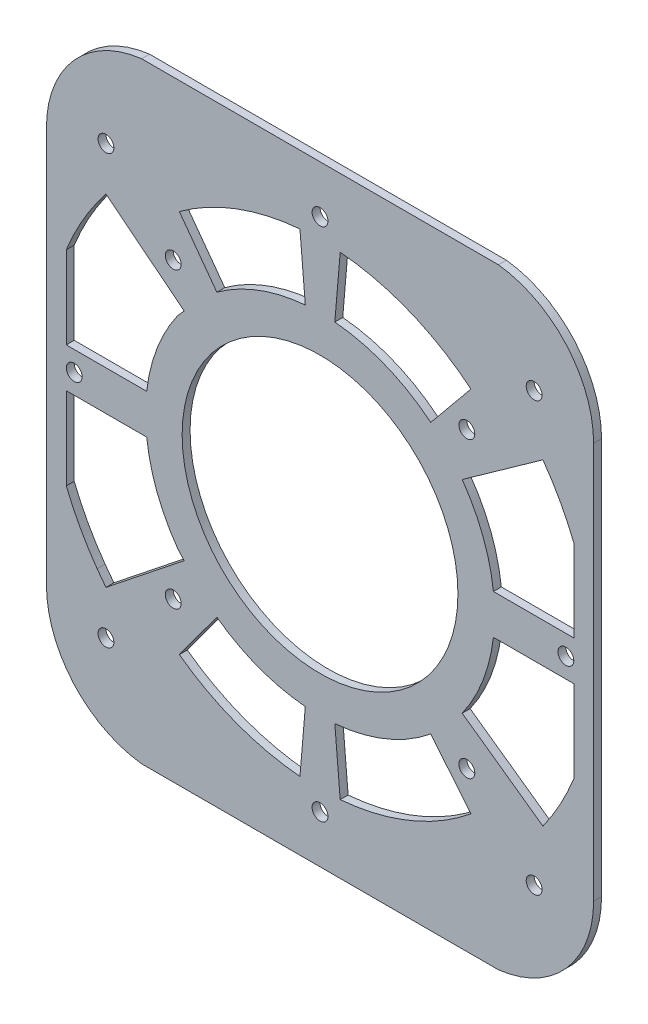
from build123d import *

# Parameters (mm, degrees)
SKETCH1_W           = 90
SKETCH1_H           = 100
SKETCH1_H_2         = 22
SKETCH1_W_2         = 24
BOSS_EXTRUDE1_DEPTH = 2
CUT_EXTRUDE1_DEPTH  = 10
CUT_EXTRUDE2_DEPTH  = 10
SKETCH4_R           = 30
CUT_EXTRUDE3_DEPTH  = 10
CUT_EXTRUDE4_DEPTH  = 10
CUT_EXTRUDE5_DEPTH  = 10
BOSS_EXTRUDE3_START = -2
SKETCH8_R           = 30
SKETCH8_R_2         = 28
BOSS_EXTRUDE3_DEPTH = 2
BOSS_EXTRUDE5_DEPTH = 2
BOSS_EXTRUDE6_DEPTH = 2
SKETCH11_R          = 34.778777804
CUT_EXTRUDE6_DEPTH  = 10
SKETCH12_R          = 2
CUT_EXTRUDE7_DEPTH  = 10


with BuildPart() as part:
    # Sketch1 → Boss-Extrude1 (new body)
    with BuildSketch(Plane.XY):
        Rectangle(SKETCH1_W, SKETCH1_H)
        with Locations((0, 61)):
            Rectangle(SKETCH1_W, SKETCH1_H_2)
        with Locations((57, 0)):
            Rectangle(SKETCH1_W_2, SKETCH1_H)
        with BuildLine():
            Line((45, 50), (69, 50))
            ThreePointArc((69, 50), (61.278820596, 65.667804287), (45, 72))
            Line((45, 72), (45, 50))
        make_face()
        with BuildLine():
            ThreePointArc((45, -72), (61.83891888, -66.278820596), (69, -50))
            Line((69, -50), (45, -50))
            Line((45, -50), (45, -72))
        make_face()
        with Locations((0, -61)):
            Rectangle(SKETCH1_W, SKETCH1_H_2)
        with BuildLine():
            Line((-45, -72), (-45, -50))
            Line((-45, -50), (-69, -50))
            ThreePointArc((-69, -50), (-61.278820596, -65.667804287), (-45, -72))
        make_face()
        with Locations((-57, 0)):
            Rectangle(SKETCH1_W_2, SKETCH1_H)
        with BuildLine():
            Line((-69, 50), (-45, 50))
            Line((-45, 50), (-45, 72))
            ThreePointArc((-45, 72), (-61.83891888, 66.278820596), (-69, 50))
        make_face()
    extrude(amount=BOSS_EXTRUDE1_DEPTH)

    # Sketch2 → Cut-Extrude1 (cut)
    with BuildSketch(Plane.XY.offset(2)):
        with BuildLine():
            Line((-60.760739313, 25.787593916), (-64, 15.649215929))
            Line((-64, 15.649215929), (-64, 5))
            Line((-64, 5), (-43.724760028, 5))
            ThreePointArc((-43.724760028, 5), (-41.091915324, 15.757827722), (-35.856683042, 25.517698186))
            Line((-35.856683042, 25.517698186), (-56.217391304, 40.007560722))
            ThreePointArc((-56.217391304, 40.007560722), (-60.52773874, 33.126920216), (-64, 25.787593916))
            Line((-64, 25.787593916), (-60.760739313, 25.787593916))
        make_face()
        with BuildLine():
            Line((-64, -5), (-64, -25.787593916))
            ThreePointArc((-64, -25.787593916), (-60.52773874, -33.126920216), (-56.217391304, -40.007560722))
            Line((-56.217391304, -40.007560722), (-35.856683042, -25.517698186))
            ThreePointArc((-35.856683042, -25.517698186), (-41.091915324, -15.757827722), (-43.724760028, -5))
            Line((-43.724760028, -5), (-64, -5))
        make_face()
        with BuildLine():
            Line((-35.483097289, 48.383362913), (-26.026680798, 35.488963441))
            ThreePointArc((-26.026680798, 35.488963441), (-15.448259809, 41.209293956), (-3.716315379, 43.852521472))
            Line((-3.716315379, 43.852521472), (-5.066584601, 59.785698294))
            ThreePointArc((-5.066584601, 59.785698294), (-21.061160661, 56.182092446), (-35.483097289, 48.383362913))
        make_face()
        with BuildLine():
            ThreePointArc((64, 25.787593916), (60.52773874, 33.126920216), (56.217391304, 40.007560722))
            Line((56.217391304, 40.007560722), (35.856683042, 25.517698186))
            ThreePointArc((35.856683042, 25.517698186), (41.091915324, 15.757827722), (43.724760028, 5))
            Line((43.724760028, 5), (64, 5))
            Line((64, 5), (64, 25.787593916))
        make_face()
        with BuildLine():
            Line((-26.026680798, -35.488963441), (-35.483097289, -48.383362913))
            ThreePointArc((-35.483097289, -48.383362913), (-21.061160661, -56.182092446), (-5.066584601, -59.785698294))
            Line((-5.066584601, -59.785698294), (-3.716315379, -43.852521472))
            ThreePointArc((-3.716315379, -43.852521472), (-15.448259809, -41.209293956), (-26.026680798, -35.488963441))
        make_face()
        with BuildLine():
            ThreePointArc((56.217391304, -40.007560722), (60.52773874, -33.126920216), (64, -25.787593916))
            Line((64, -25.787593916), (64, -5))
            Line((64, -5), (43.724760028, -5))
            ThreePointArc((43.724760028, -5), (41.091915324, -15.757827722), (35.856683042, -25.517698186))
            Line((35.856683042, -25.517698186), (56.217391304, -40.007560722))
        make_face()
        with BuildLine():
            Line((27.916279909, 34.022580083), (38.059254795, 46.384190458))
            ThreePointArc((38.059254795, 46.384190458), (22.588514074, 55.585600941), (5.084745763, 59.784156434))
            Line((5.084745763, 59.784156434), (3.729636503, 43.851390526))
            ThreePointArc((3.729636503, 43.851390526), (16.568566174, 40.771770312), (27.916279909, 34.022580083))
        make_face()
        with BuildLine():
            Line((3.729636503, -43.851390526), (5.084745763, -59.784156434))
            ThreePointArc((5.084745763, -59.784156434), (22.588514074, -55.585600941), (38.059254795, -46.384190458))
            Line((38.059254795, -46.384190458), (27.916279909, -34.022580083))
            ThreePointArc((27.916279909, -34.022580083), (16.568566174, -40.771770312), (3.729636503, -43.851390526))
        make_face()
    extrude(amount=-CUT_EXTRUDE1_DEPTH, mode=Mode.SUBTRACT)

    # Sketch3 → Cut-Extrude2 (cut)
    with BuildSketch(Plane.XY.offset(2)):
        Polygon((-64, 25.787593916), (-64, 15.649215929), (-60.760739313, 25.787593916), align=None)
    extrude(amount=-CUT_EXTRUDE2_DEPTH, mode=Mode.SUBTRACT)

    # Sketch4 → Cut-Extrude3 (cut)
    with BuildSketch(Plane(origin=(0, 0, 0), x_dir=(-1, 0, 0), z_dir=(0, 0, -1))):
        Circle(SKETCH4_R)
    extrude(amount=-CUT_EXTRUDE3_DEPTH, mode=Mode.SUBTRACT)

    # Sketch6 → Cut-Extrude4 (cut)
    with BuildSketch(Plane.XY.offset(2)):
        Polygon((-35.856683042, -25.517698186), (-56.217391304, -40.007560722), (-50.280397209, -40.007560722), (-34.257403731, -27.258240508), align=None)
        Polygon((-50.280397209, 40.007560722), (-56.217391304, 40.007560722), (-35.856683042, 25.517698186), (-34.257403731, 27.258240508), align=None)
        Polygon((-50.280397209, -40.007560722), (-56.217391304, -40.007560722), (-53.993303971, -42.96187992), align=None)
        Polygon((-53.993303971, 42.96187992), (-56.217391304, 40.007560722), (-50.280397209, 40.007560722), align=None)
    extrude(amount=-CUT_EXTRUDE4_DEPTH, mode=Mode.SUBTRACT)

    # Sketch7 → Cut-Extrude5 (cut)
    with BuildSketch(Plane.XY.offset(2)):
        Polygon((-32.560271117, 27.267561972), (-24.823321267, 33.603144582), (-18.487738656, 25.866194731), (-26.224688507, 19.530612121), align=None)
        Polygon((27.827762823, 32.155388995), (19.915267174, 26.040455421), (26.030200748, 18.127959772), (33.942696396, 24.242893346), align=None)
        Polygon((33.988304577, -25.549058378), (27.336365779, -18.082351592), (19.869658993, -24.734290389), (26.521597791, -32.200997176), align=None)
        Polygon((-26.126682472, -33.612215797), (-18.478667441, -27.169555937), (-24.921327301, -19.521540905), (-32.569342333, -25.964200766), align=None)
    extrude(amount=-CUT_EXTRUDE5_DEPTH, mode=Mode.SUBTRACT)

    # Sketch8 → Boss-Extrude3 (add)
    with BuildSketch(Plane.XY.offset(2).offset(BOSS_EXTRUDE3_START)):
        Circle(SKETCH8_R)
        Circle(SKETCH8_R_2, mode=Mode.SUBTRACT)
    extrude(amount=BOSS_EXTRUDE3_DEPTH)

    # Sketch9 → Boss-Extrude5 (add)
    with BuildSketch(Plane(origin=(0, 0, 0), x_dir=(-1, 0, 0), z_dir=(0, 0, -1))):
        Polygon((32.694861491, 27.157349491), (26.359278881, 19.420399641), (18.487738656, 25.866194731), (24.823321267, 33.603144582), align=None)
        Polygon((32.547632539, -25.945912516), (26.104972678, -33.593927547), (18.478667441, -27.169555937), (24.921327301, -19.521540905), align=None)
        Polygon((-27.336365779, -18.082351592), (-34.046734551, -25.614645193), (-26.580027765, -32.266583991), (-19.869658993, -24.734290389), align=None)
        Polygon((-27.829205352, 32.153522415), (-19.916709703, 26.038588842), (-26.030200748, 18.127959772), (-33.942696396, 24.242893346), align=None)
        with BuildLine():
            Line((-45, 72), (0, 72))
            Line((0, 72), (0, 77))
            Line((0, 77), (-45, 77))
            ThreePointArc((-45, 77), (-62.132690852, 68.062391868), (-69, 50))
            ThreePointArc((-69, 50), (-61.278820596, 65.667804287), (-45, 72))
        make_face()
        with BuildLine():
            Line((0, 77), (0, 72))
            Line((0, 72), (45, 72))
            ThreePointArc((45, 72), (61.278820596, 65.667804287), (69, 50))
            ThreePointArc((69, 50), (62.132690852, 68.062391868), (45, 77))
            Line((45, 77), (0, 77))
        make_face()
        with BuildLine():
            ThreePointArc((45, -77), (62.132690852, -68.062391868), (69, -50))
            ThreePointArc((69, -50), (61.278820596, -65.667804287), (45, -72))
            Line((45, -72), (0, -72))
            Line((0, -72), (0, -77))
            Line((0, -77), (45, -77))
        make_face()
        with BuildLine():
            ThreePointArc((-45, -72), (-61.278820596, -65.667804287), (-69, -50))
            ThreePointArc((-69, -50), (-62.132690852, -68.062391868), (-45, -77))
            Line((-45, -77), (0, -77))
            Line((0, -77), (0, -72))
            Line((0, -72), (-45, -72))
        make_face()
    extrude(amount=-BOSS_EXTRUDE5_DEPTH)

    # Sketch10 → Boss-Extrude6 (add)
    with BuildSketch(Plane(origin=(0, 0, 0), x_dir=(-1, 0, 0), z_dir=(0, 0, -1))):
        Polygon((-27.829205352, 32.153522415), (-27.827762823, 32.155388995), (-19.915267174, 26.040455421), (-19.916709703, 26.038588842), align=None)
        Polygon((26.104972678, -33.593927547), (26.126682472, -33.612215797), (32.568924212, -25.964697113), (32.547214419, -25.946408862), align=None)
    extrude(amount=-BOSS_EXTRUDE6_DEPTH)

    # Sketch11 → Cut-Extrude6 (cut)
    with BuildSketch(Plane(origin=(0, 0, 0), x_dir=(-1, 0, 0), z_dir=(0, 0, -1))):
        Circle(SKETCH11_R)
    extrude(amount=-CUT_EXTRUDE6_DEPTH, mode=Mode.SUBTRACT)

    # Sketch12 → Cut-Extrude7 (cut)
    with BuildSketch(Plane.XY.offset(2)):
        with Locations((0, -65)):
            Circle(SKETCH12_R)
        with Locations((62, 0)):
            Circle(SKETCH12_R)
        with Locations((-62, 0)):
            Circle(SKETCH12_R)
        with Locations((0, 65)):
            Circle(SKETCH12_R)
        with Locations((-37.029437252, 37.029437252)):
            Circle(SKETCH12_R)
        with Locations((-54, 54)):
            Circle(SKETCH12_R)
        with Locations((54, 54)):
            Circle(SKETCH12_R)
        with Locations((37.029437252, 37.029437252)):
            Circle(SKETCH12_R)
        with Locations((-54, -54)):
            Circle(SKETCH12_R)
        with Locations((-37.029437252, -37.029437252)):
            Circle(SKETCH12_R)
        with Locations((37.029437252, -37.029437252)):
            Circle(SKETCH12_R)
        with Locations((54, -54)):
            Circle(SKETCH12_R)
    extrude(amount=-CUT_EXTRUDE7_DEPTH, mode=Mode.SUBTRACT)


solid = part.part
